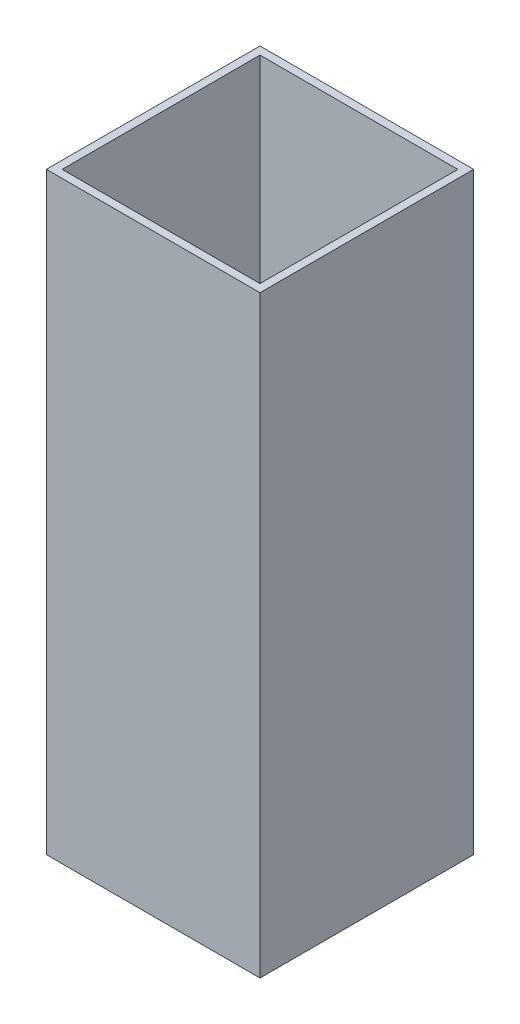
from build123d import *

# Parameters (mm, degrees)
SKETCH1_W           = 27
SKETCH1_H           = 27
BOSS_EXTRUDE2_DEPTH = 75
SHELL1_T            = -1
SCALE1_SCALE        = 5


with BuildPart() as part:
    # Sketch1 → Boss-Extrude2 (new body)
    with BuildSketch(Plane(origin=(0, 0, 0), x_dir=(1, 0, 0), z_dir=(0, 1, 0))):
        Rectangle(SKETCH1_W, SKETCH1_H)
    extrude(amount=BOSS_EXTRUDE2_DEPTH)

    # Shell1
    shell1_openings = [part.faces().sort_by_distance(p)[0] for p in [
        (0, 75, 0),
    ]]
    offset(amount=SHELL1_T, openings=shell1_openings, kind=Kind.INTERSECTION)


with BuildPart() as part_1:
    # Scale1: scaled about (0, 0, 0)
    add(part.part.scale(SCALE1_SCALE))


solid = part_1.part
